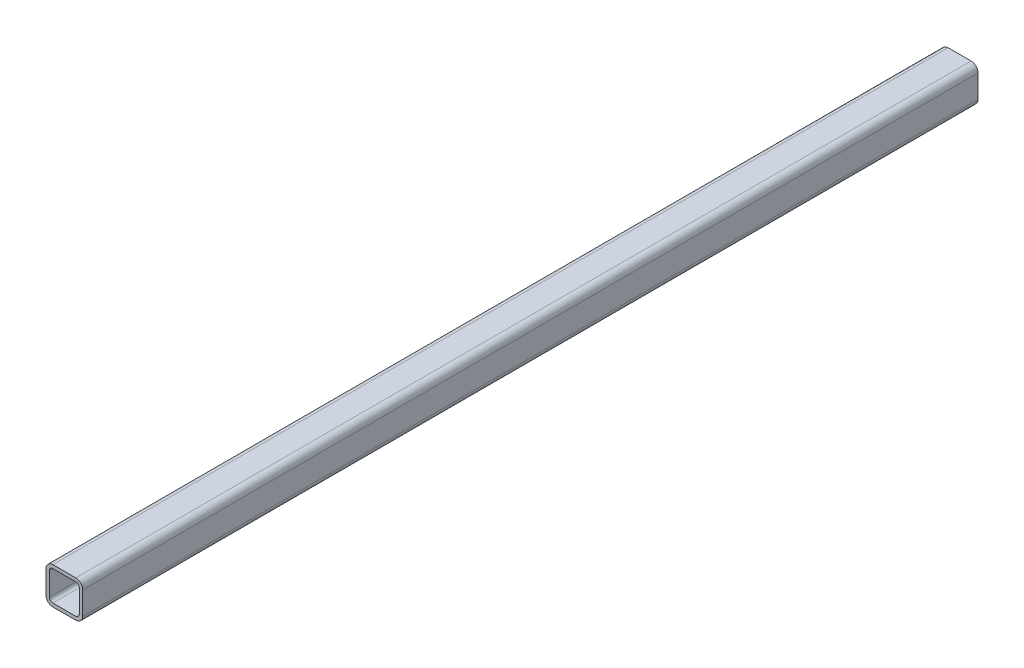
from build123d import *

# Parameters (mm, degrees)
DODANIE_WYCI_GNI_CIE1_DEPTH = 1239.2


with BuildPart() as part:
    # Szkic1 → Dodanie-wyciągnięcie1 (new body)
    with BuildSketch(Plane.XY):
        with BuildLine():
            Line((9.53, 0), (41.27, 0))
            ThreePointArc((41.27, 0), (48.008727625, 2.791272375), (50.8, 9.53))
            Line((50.8, 9.53), (50.8, 41.27))
            ThreePointArc((50.8, 41.27), (48.008727625, 48.008727625), (41.27, 50.8))
            Line((41.27, 50.8), (9.53, 50.8))
            ThreePointArc((9.53, 50.8), (2.791272375, 48.008727625), (0, 41.27))
            Line((0, 41.27), (0, 9.53))
            ThreePointArc((0, 9.53), (2.791272375, 2.791272375), (9.53, 0))
        make_face()
        with BuildLine():
            Line((9.52, 46.04), (41.28, 46.04))
            ThreePointArc((41.28, 46.04), (44.645828278, 44.645828278), (46.04, 41.28))
            Line((46.04, 41.28), (46.04, 9.52))
            ThreePointArc((46.04, 9.52), (44.645828278, 6.154171722), (41.28, 4.76))
            Line((41.28, 4.76), (9.52, 4.76))
            ThreePointArc((9.52, 4.76), (6.154171722, 6.154171722), (4.76, 9.52))
            Line((4.76, 9.52), (4.76, 41.28))
            ThreePointArc((4.76, 41.28), (6.154171722, 44.645828278), (9.52, 46.04))
        make_face(mode=Mode.SUBTRACT)
    extrude(amount=DODANIE_WYCI_GNI_CIE1_DEPTH)


solid = part.part
